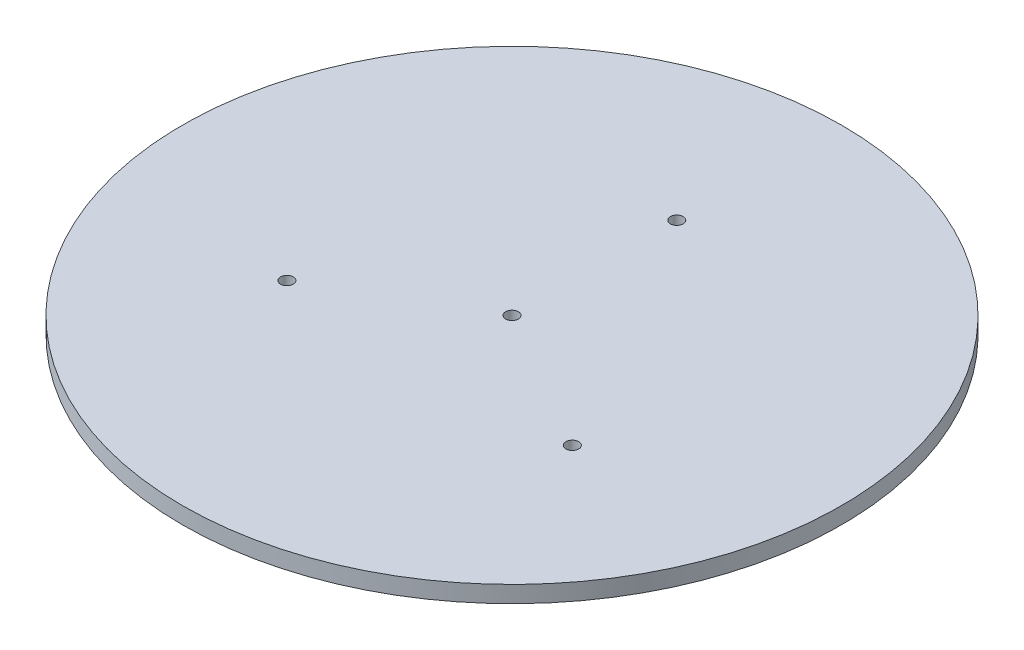
from build123d import *

# Parameters (mm, degrees)
SKETCH1_R           = 125.38075
SKETCH1_R_2         = 2.4257
BOSS_EXTRUDE1_DEPTH = 6.35


with BuildPart() as part:
    # Sketch1 → Boss-Extrude1 (new body)
    with BuildSketch(Plane(origin=(0, 0, 0), x_dir=(1, 0, 0), z_dir=(0, 1, 0))):
        with Locations(Location((0, 0, 0), (0, 0, 270))):
            Circle(SKETCH1_R)
        with Locations(Location((0, 62.690375, 0), (0, 0, 270))):
            Circle(SKETCH1_R_2, mode=Mode.SUBTRACT)
        with Locations(Location((54.291457323, -31.3451875, 0), (0, 0, 270))):
            Circle(SKETCH1_R_2, mode=Mode.SUBTRACT)
        with Locations(Location((-54.291457323, -31.3451875, 0), (0, 0, 270))):
            Circle(SKETCH1_R_2, mode=Mode.SUBTRACT)
        with Locations(Location((0, 0, 0), (0, 0, 270))):
            Circle(SKETCH1_R_2, mode=Mode.SUBTRACT)
    extrude(amount=BOSS_EXTRUDE1_DEPTH)


solid = part.part
